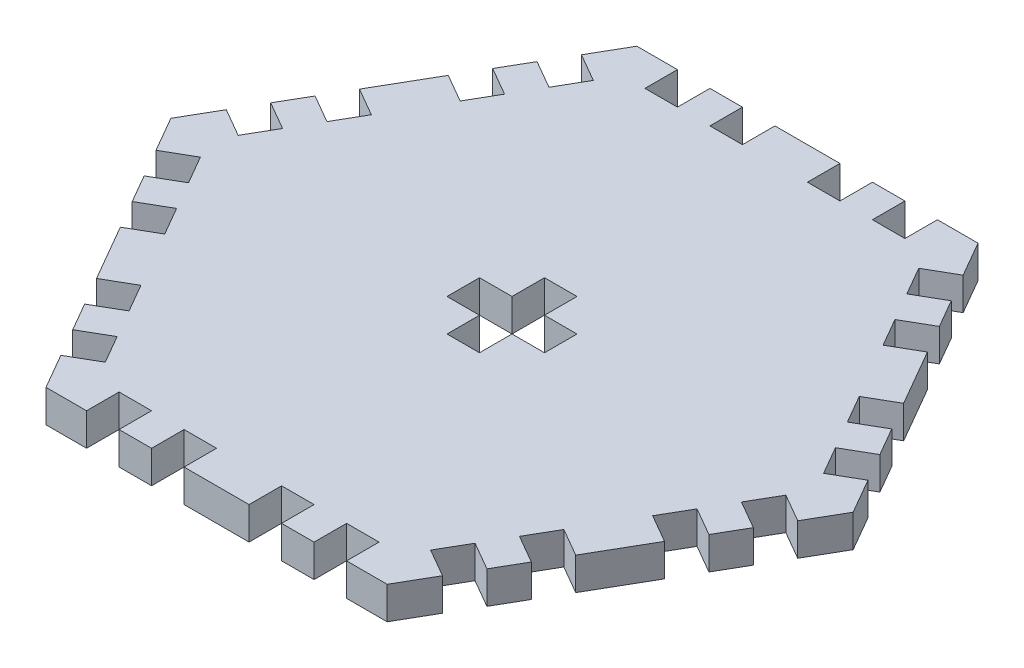
from build123d import *

# Parameters (mm, degrees)
BOSS_EXTRUDE1_DEPTH = 5.08
SKETCH3_W           = 5.08
SKETCH3_H           = 5.08
CUT_EXTRUDE1_DEPTH  = 5.08
CUT_EXTRUDE2_DEPTH  = 5.08


with BuildPart() as part:
    # Sketch1 → Boss-Extrude1 (new body)
    with BuildSketch(Plane(origin=(0, 0, 0), x_dir=(1, 0, 0), z_dir=(0, 1, 0))):
        Polygon((53.32, 0), (26.66, 46.17647453), (-26.66, 46.17647453), (-53.32, 0), (-26.66, -46.17647453), (26.66, -46.17647453), align=None)
    extrude(amount=BOSS_EXTRUDE1_DEPTH)

    # Sketch3 → Cut-Extrude1 (cut)
    with BuildSketch(Plane(origin=(0, 5.08, 0), x_dir=(1, 0, 0), z_dir=(0, 1, 0))):
        with Locations((-17.78, 43.63647453)):
            Rectangle(SKETCH3_W, SKETCH3_H)
        with Locations((7.62, 43.63647453)):
            Rectangle(SKETCH3_W, SKETCH3_H)
        with Locations((17.78, 43.63647453)):
            Rectangle(SKETCH3_W, SKETCH3_H)
        with Locations((-7.62, 43.63647453)):
            Rectangle(SKETCH3_W, SKETCH3_H)
        Polygon((29.83, 40.68587347), (25.430590949, 38.14587347), (27.970590949, 33.746464419), (32.37, 36.286464419), align=None)
        Polygon((42.53, 18.688828214), (45.07, 14.289419162), (40.670590949, 11.749419162), (38.130590949, 16.148828214), align=None)
        Polygon((47.61, 9.890010111), (50.15, 5.49060106), (45.750590949, 2.95060106), (43.210590949, 7.350010111), align=None)
        Polygon((34.91, 31.887055367), (30.510590949, 29.347055367), (33.050590949, 24.947646316), (37.45, 27.487646316), align=None)
        Polygon((50.15, -5.49060106), (45.750590949, -2.95060106), (43.210590949, -7.350010111), (47.61, -9.890010111), align=None)
        Polygon((37.45, -27.487646316), (34.91, -31.887055367), (30.510590949, -29.347055367), (33.050590949, -24.947646316), align=None)
        Polygon((32.37, -36.286464419), (29.83, -40.68587347), (25.430590949, -38.14587347), (27.970590949, -33.746464419), align=None)
        Polygon((45.07, -14.289419162), (40.670590949, -11.749419162), (38.130590949, -16.148828214), (42.53, -18.688828214), align=None)
        with Locations((17.78, -43.63647453)):
            Rectangle(SKETCH3_W, SKETCH3_H)
        with Locations((-7.62, -43.63647453)):
            Rectangle(SKETCH3_W, SKETCH3_H)
        with Locations((-17.78, -43.63647453)):
            Rectangle(SKETCH3_W, SKETCH3_H)
        with Locations((7.62, -43.63647453)):
            Rectangle(SKETCH3_W, SKETCH3_H)
        Polygon((-29.83, -40.68587347), (-25.430590949, -38.14587347), (-27.970590949, -33.746464419), (-32.37, -36.286464419), align=None)
        Polygon((-42.53, -18.688828214), (-45.07, -14.289419162), (-40.670590949, -11.749419162), (-38.130590949, -16.148828214), align=None)
        Polygon((-47.61, -9.890010111), (-50.15, -5.49060106), (-45.750590949, -2.95060106), (-43.210590949, -7.350010111), align=None)
        Polygon((-34.91, -31.887055367), (-30.510590949, -29.347055367), (-33.050590949, -24.947646316), (-37.45, -27.487646316), align=None)
        Polygon((-50.15, 5.49060106), (-45.750590949, 2.95060106), (-43.210590949, 7.350010111), (-47.61, 9.890010111), align=None)
        Polygon((-37.45, 27.487646316), (-34.91, 31.887055367), (-30.510590949, 29.347055367), (-33.050590949, 24.947646316), align=None)
        Polygon((-32.37, 36.286464419), (-29.83, 40.68587347), (-25.430590949, 38.14587347), (-27.970590949, 33.746464419), align=None)
        Polygon((-45.07, 14.289419162), (-40.670590949, 11.749419162), (-38.130590949, 16.148828214), (-42.53, 18.688828214), align=None)
    extrude(amount=-CUT_EXTRUDE1_DEPTH, mode=Mode.SUBTRACT)

    # Sketch4 → Cut-Extrude2 (cut)
    with BuildSketch(Plane(origin=(0, 5.08, 0), x_dir=(1, 0, 0), z_dir=(0, 1, 0))):
        Polygon((0, 7.62), (2.54, 7.62), (2.54, 2.54), (7.62, 2.54), (7.62, 0), (7.62, -2.54), (2.54, -2.54), (2.54, -7.62), (0, -7.62), (-2.54, -7.62), (-2.54, -2.54), (-7.62, -2.54), (-7.62, 0), (-7.62, 2.54), (-2.54, 2.54), (-2.54, 7.62), align=None)
    extrude(amount=-CUT_EXTRUDE2_DEPTH, mode=Mode.SUBTRACT)


solid = part.part
